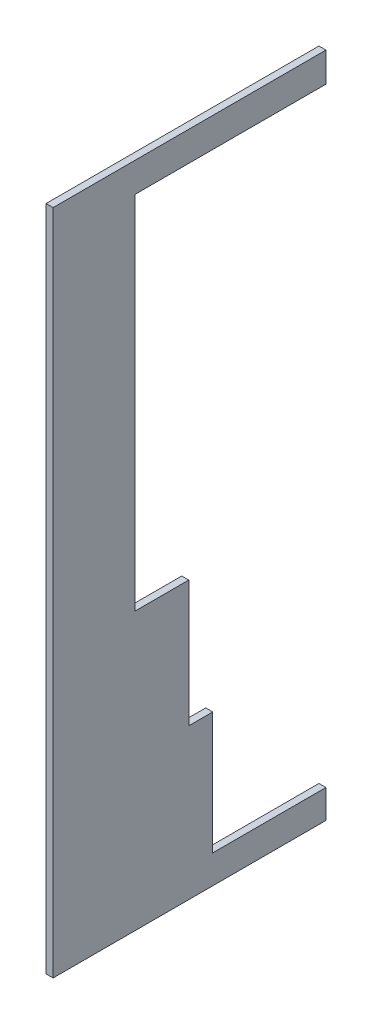
from build123d import *

# Parameters (mm, degrees)
SKETCH_1_W          = 95
SKETCH_1_H          = 38.85
EXTRUDE_1_DEPTH     = 0.5
SKETCH_2_W          = 38.85
SKETCH_2_H          = 95
EXTRUDE_2_DEPTH     = 0.5
CUT_EXTRUDE_1_DEPTH = 110.347085009


with BuildPart() as part:
    # Эскиз1 → Бобышка-Вытянуть1 (new body)
    with BuildSketch(Plane(origin=(0.5, 0, 0), x_dir=(0, -1, 0), z_dir=(-1, 0, 0))):
        with Locations((-53.35, 22.825)):
            Rectangle(SKETCH_1_W, SKETCH_1_H)
    extrude(amount=-EXTRUDE_1_DEPTH)

    # Эскиз2 → Бобышка-Вытянуть2 (add)
    with BuildSketch(Plane.ZY.offset(-0.5)):
        with Locations((22.825, 53.35)):
            Rectangle(SKETCH_2_W, SKETCH_2_H)
    extrude(amount=EXTRUDE_2_DEPTH)

    # Эскиз3 → Вырез-Вытянуть1 (cut, through all)
    with BuildSketch(Plane.ZY):
        Polygon((22.925859733, 27.290305028), (19.520373336, 27.290305028), (19.520373336, 9.916579837), (-2.735278428, 9.916579837), (-2.735278428, 27.290305028), (-2.735278428, 45.262642497), (-2.735278428, 96.642195874), (30.596303396, 96.642195874), (30.596303396, 45.262642497), (22.925859733, 45.262642497), align=None)
    extrude(amount=-CUT_EXTRUDE_1_DEPTH, mode=Mode.SUBTRACT)


solid = part.part
